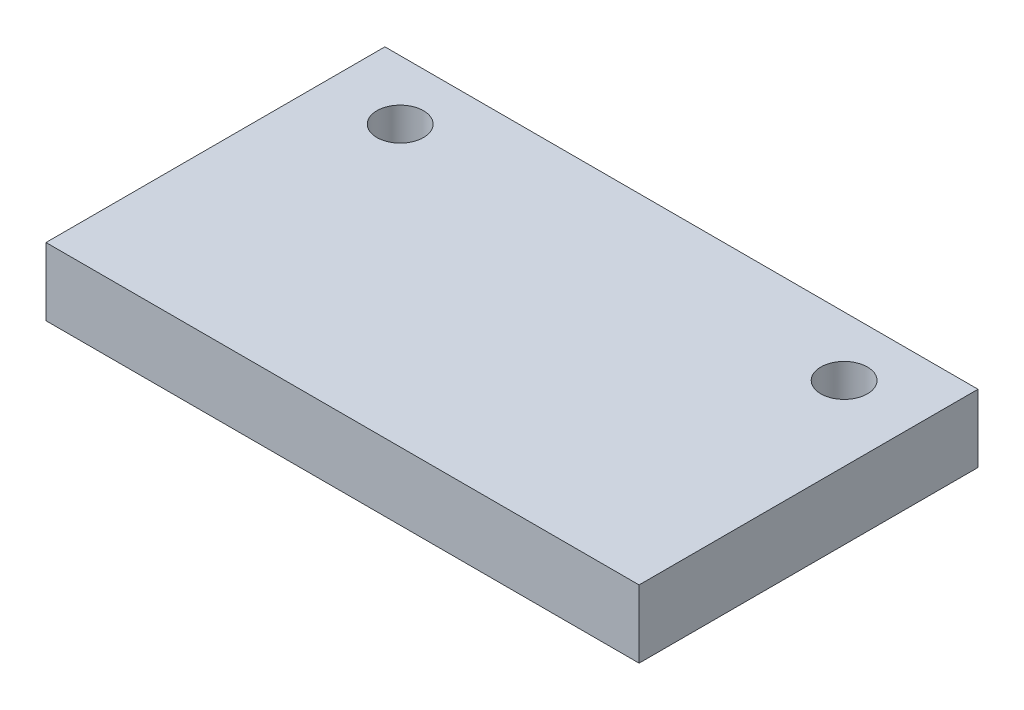
from build123d import *

# Parameters (mm, degrees)
SKETCH1_W           = 700
SKETCH1_H           = 400
BOSS_EXTRUDE1_DEPTH = 80
SKETCH3_R           = 27.5
CUT_EXTRUDE1_DEPTH  = 80
SKETCH3_4_R         = 27.5
CUT_EXTRUDE2_DEPTH  = 80


with BuildPart() as part:
    # Sketch1 → Boss-Extrude1 (new body)
    with BuildSketch(Plane(origin=(0, 0, 0), x_dir=(1, 0, 0), z_dir=(0, 1, 0))):
        with Locations((28.391959799, -57.537688442)):
            Rectangle(SKETCH1_W, SKETCH1_H)
    extrude(amount=BOSS_EXTRUDE1_DEPTH)

    # Sketch3 → Cut-Extrude1 (cut)
    with BuildSketch(Plane(origin=(0, 80, 0), x_dir=(1, 0, 0), z_dir=(0, 1, 0))):
        with Locations((-233.57645152, 72.474774931)):
            Circle(SKETCH3_R)
    extrude(amount=-CUT_EXTRUDE1_DEPTH, mode=Mode.SUBTRACT)

    # Sketch3<4> → Cut-Extrude2 (cut)
    with BuildSketch(Plane(origin=(0, 80, 0), x_dir=(1, 0, 0), z_dir=(0, 1, 0))):
        with Locations((290.360371117, 72.474774931)):
            Circle(SKETCH3_4_R)
    extrude(amount=-CUT_EXTRUDE2_DEPTH, mode=Mode.SUBTRACT)


solid = part.part
